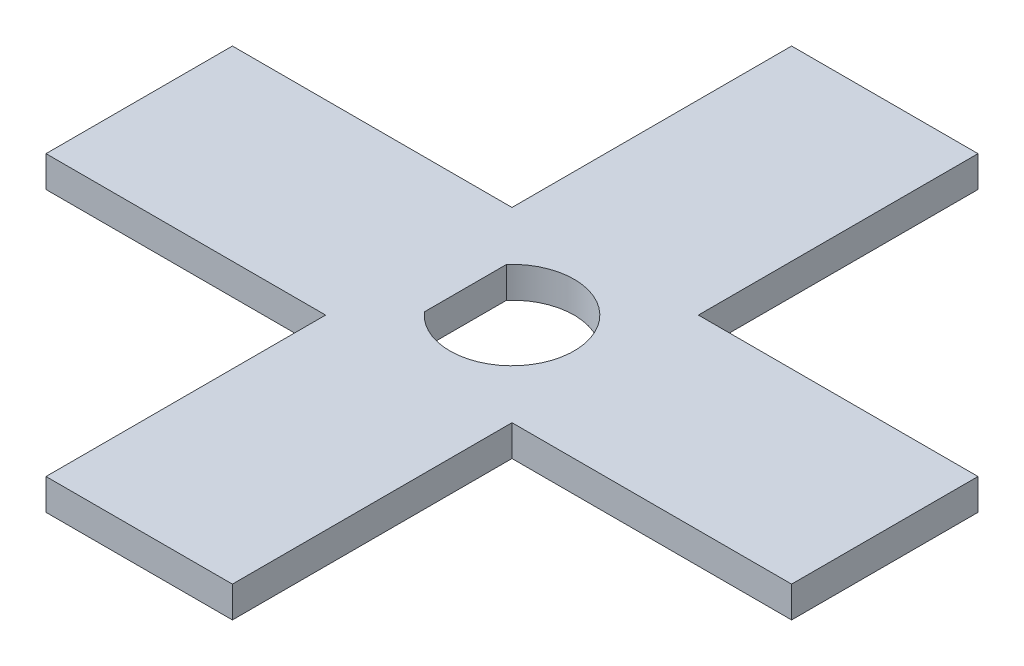
from build123d import *

# Parameters (mm, degrees)
BOSS_EXTRUDE1_DEPTH = 2
CUT_EXTRUDE2_DEPTH  = 35


with BuildPart() as part:
    # Sketch1 → Boss-Extrude1 (new body)
    with BuildSketch(Plane(origin=(0, 0, 0), x_dir=(1, 0, 0), z_dir=(0, 1, 0))):
        Polygon((-6, 6), (-6, 24), (6, 24), (6, 6), (24, 6), (24, -6), (6, -6), (6, -24), (-6, -24), (-6, -6), (-24, -6), (-24, 6), align=None)
    extrude(amount=BOSS_EXTRUDE1_DEPTH)

    # Sketch2 → Cut-Extrude2 (cut, through all)
    with BuildSketch(Plane(origin=(0, 0, 0), x_dir=(1, 0, 0), z_dir=(0, 1, 0))):
        with BuildLine():
            Line((-3, -2.645751311), (-3, 2.645751311))
            ThreePointArc((-3, 2.645751311), (4, 0), (-3, -2.645751311))
        make_face()
    extrude(amount=CUT_EXTRUDE2_DEPTH, mode=Mode.SUBTRACT)


solid = part.part
